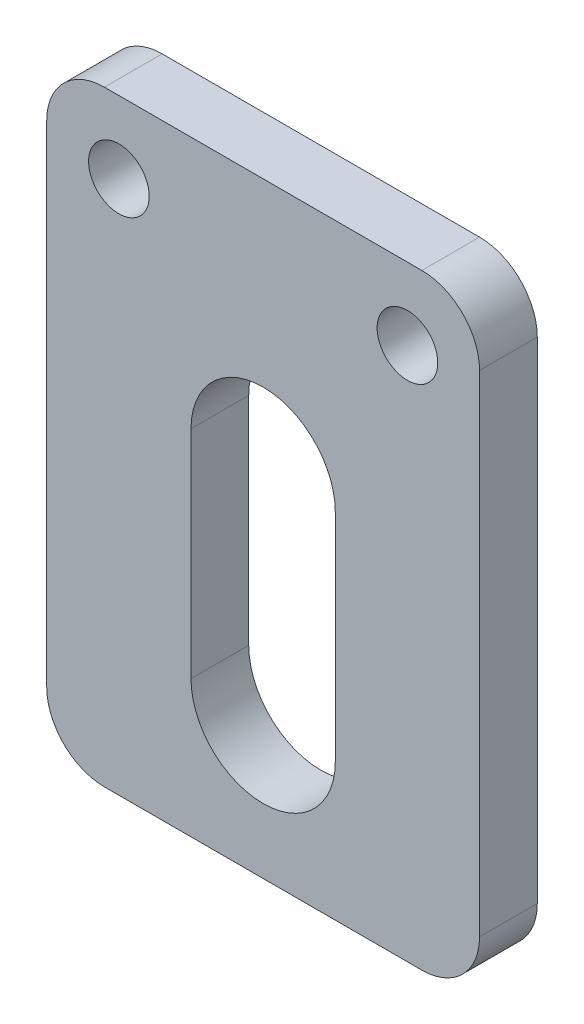
from build123d import *

# Parameters (mm, degrees)
SKETCH_1_W          = 30
SKETCH_1_H          = 42
EXTRUDE_1_DEPTH     = 4
SKETCH_2_R          = 2.1
CUT_EXTRUDE_1_DEPTH = 52.768716422
FILLET_1_R          = 4


with BuildPart() as part:
    # 草图1 → 凸台-拉伸1 (new body)
    with BuildSketch(Plane.XY):
        with Locations((15, -21)):
            Rectangle(SKETCH_1_W, SKETCH_1_H)
    extrude(amount=EXTRUDE_1_DEPTH)

    # 草图2 → 切除-拉伸1 (cut, through all)
    with BuildSketch(Plane.XY.offset(4)):
        with Locations((5, -5)):
            Circle(SKETCH_2_R)
        with Locations((25, -5)):
            Circle(SKETCH_2_R)
        with BuildLine():
            Line((20, -17.5), (20, -32.5))
            ThreePointArc((20, -32.5), (15, -37.5), (10, -32.5))
            Line((10, -32.5), (10, -17.5))
            ThreePointArc((10, -17.5), (15, -12.5), (20, -17.5))
        make_face()
    extrude(amount=-CUT_EXTRUDE_1_DEPTH, mode=Mode.SUBTRACT)

    # 圆角1
    fillet_1_edges = [part.edges().sort_by_distance(p)[0] for p in [
        (0, 0, 2),
        (30, 0, 2),
        (30, -42, 2),
        (0, -42, 2),
    ]]
    fillet(fillet_1_edges, radius=FILLET_1_R)


solid = part.part
